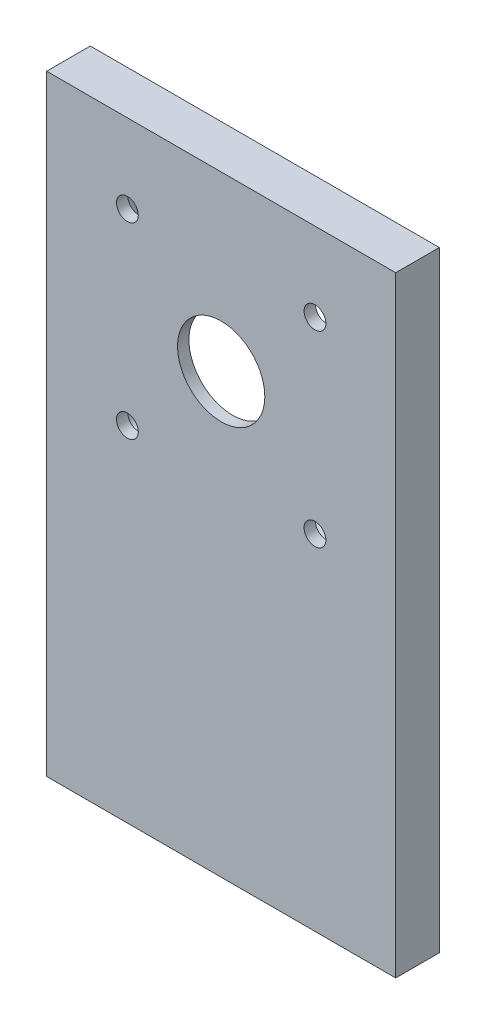
from build123d import *

# Parameters (mm, degrees)
SKETCH1_W                  = 101.6
SKETCH1_H                  = 177.8
BOSS_EXTRUDE1_DEPTH        = 12.7
F_10_32_TAPPED_HOLE1_D     = 4.0386
F_10_32_TAPPED_HOLE1_DEPTH = 25.4
F_10_32_TAPPED_HOLE1_TIP   = 1.213317848
SKETCH5_R                  = 12.7
SKETCH5_R_2                = 3.175
CUT_EXTRUDE1_DEPTH         = 104.175287739
SKETCH6_W                  = 61.595
SKETCH6_H                  = 61.595
CUT_EXTRUDE2_DEPTH         = 9.398
FILLET1_R                  = 3.175
SKETCH7_W                  = 67.945
SKETCH7_H                  = 67.945
CUT_EXTRUDE3_DEPTH         = 4.445
FILLET2_R                  = 3.175


with BuildPart() as part:
    # Sketch1 → Boss-Extrude1 (new body)
    with BuildSketch(Plane.XY):
        Rectangle(SKETCH1_W, SKETCH1_H)
    extrude(amount=BOSS_EXTRUDE1_DEPTH)

    # #10-32 Tapped Hole1
    with Locations(Plane(origin=(0, -88.9, 0), x_dir=(-1, 0, 0), z_dir=(0, -1, 0))):
        with Locations((31.75, -6.35), (-31.75, -6.35)):
            Hole(F_10_32_TAPPED_HOLE1_D / 2, depth=F_10_32_TAPPED_HOLE1_DEPTH)
            with Locations((0, 0, -(F_10_32_TAPPED_HOLE1_DEPTH + F_10_32_TAPPED_HOLE1_TIP / 2))):  # 118° drill point
                Cone(0, F_10_32_TAPPED_HOLE1_D / 2, F_10_32_TAPPED_HOLE1_TIP, mode=Mode.SUBTRACT)

    # Sketch5 → Cut-Extrude1 (cut, through all)
    with BuildSketch(Plane.XY.offset(12.7)):
        with Locations((0, 38.616692093)):
            Circle(SKETCH5_R)
        with Locations((-27.305, 65.921692093)):
            Circle(SKETCH5_R_2)
        with Locations((27.305, 65.921692093)):
            Circle(SKETCH5_R_2)
        with Locations((27.305, 11.311692093)):
            Circle(SKETCH5_R_2)
        with Locations((-27.305, 11.311692093)):
            Circle(SKETCH5_R_2)
    extrude(amount=-CUT_EXTRUDE1_DEPTH, mode=Mode.SUBTRACT)

    # Sketch6 → Cut-Extrude2 (cut)
    with BuildSketch(Plane(origin=(0, 0, 0), x_dir=(-1, 0, 0), z_dir=(0, 0, -1))):
        with Locations((0, 38.616692093)):
            Rectangle(SKETCH6_W, SKETCH6_H)
    extrude(amount=-CUT_EXTRUDE2_DEPTH, mode=Mode.SUBTRACT)

    # Fillet1
    fillet1_edges = [part.edges().sort_by_distance(p)[0] for p in [
        (-30.7975, 69.414192093, 4.699),
        (-30.7975, 7.819192093, 4.699),
        (30.7975, 7.819192093, 4.699),
        (30.7975, 69.414192093, 4.699),
    ]]
    fillet(fillet1_edges, radius=FILLET1_R)

    # Sketch7 → Cut-Extrude3 (cut)
    with BuildSketch(Plane(origin=(0, 0, 0), x_dir=(-1, 0, 0), z_dir=(0, 0, -1))):
        with Locations((0, 38.616692093)):
            Rectangle(SKETCH7_W, SKETCH7_H)
    extrude(amount=-CUT_EXTRUDE3_DEPTH, mode=Mode.SUBTRACT)

    # Fillet2
    fillet2_edges = [part.edges().sort_by_distance(p)[0] for p in [
        (-33.9725, 72.589192093, 2.2225),
        (-33.9725, 4.644192093, 2.2225),
        (33.9725, 4.644192093, 2.2225),
        (33.9725, 72.589192093, 2.2225),
    ]]
    fillet(fillet2_edges, radius=FILLET2_R)


solid = part.part
